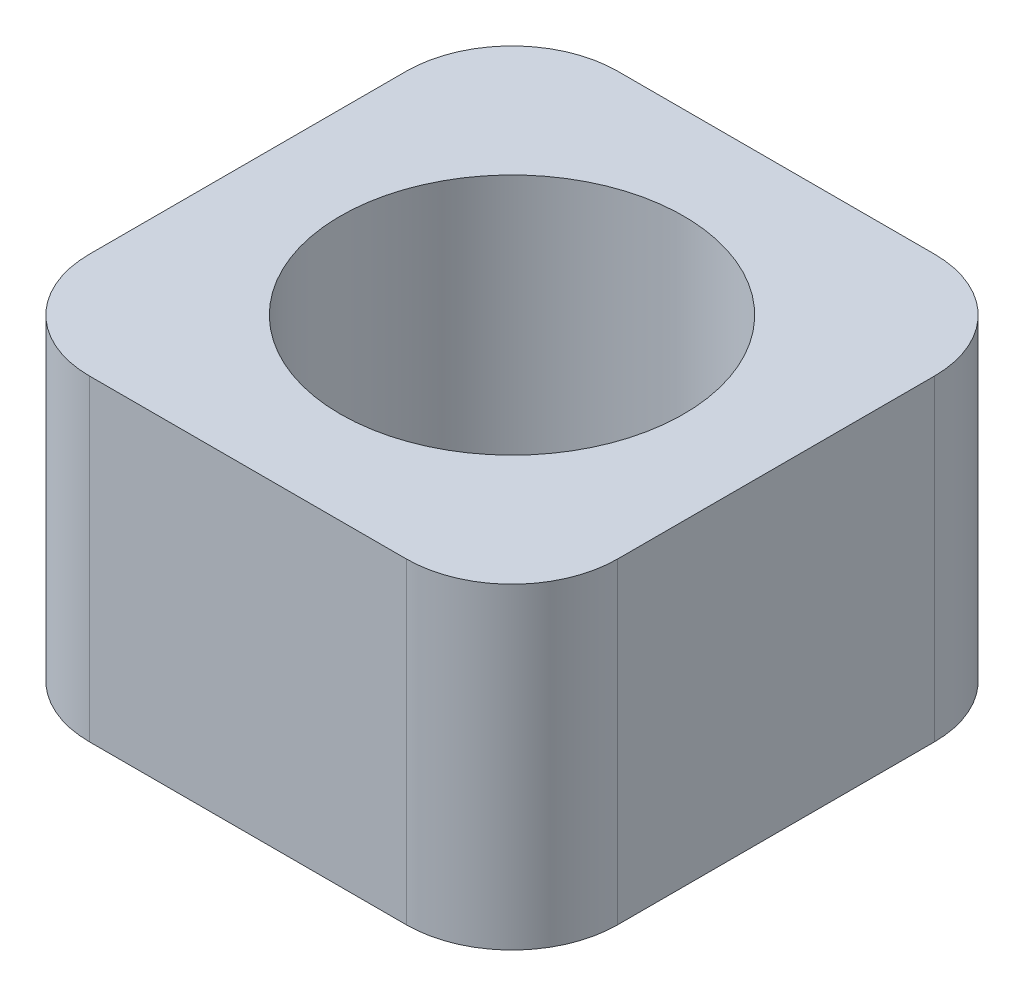
from build123d import *

# Parameters (mm, degrees)
SKETCH1_R           = 5
SKETCH1_R_2         = 3.25
BOSS_EXTRUDE1_DEPTH = 3
FILLET1_R           = 2


with BuildPart() as part:
    # Sketch1 → Boss-Extrude1 (new, symmetric)
    # profile 1 of 5: a face of its own
    with BuildSketch(Plane(origin=(0, 0, 0), x_dir=(1, 0, 0), z_dir=(0, 1, 0))):
        with BuildLine():
            Line((-5, 5), (-5, 0))
            ThreePointArc((-5, 0), (-3.535533906, 3.535533906), (0, 5))
            Line((0, 5), (-5, 5))
        make_face()
    # profile 2 of 5: a face of its own
    with BuildSketch(Plane(origin=(0, 0, 0), x_dir=(1, 0, 0), z_dir=(0, 1, 0))):
        Circle(SKETCH1_R)
        with Locations(Location((0, 0, 0), (0, 0, 270))):
            Circle(SKETCH1_R_2, mode=Mode.SUBTRACT)
    # profile 3 of 5: a face of its own
    with BuildSketch(Plane(origin=(0, 0, 0), x_dir=(1, 0, 0), z_dir=(0, 1, 0))):
        with BuildLine():
            ThreePointArc((0, 5), (3.535533906, 3.535533906), (5, 0))
            Line((5, 0), (5, 5))
            Line((5, 5), (0, 5))
        make_face()
    # profile 4 of 5: a face of its own
    with BuildSketch(Plane(origin=(0, 0, 0), x_dir=(1, 0, 0), z_dir=(0, 1, 0))):
        with BuildLine():
            ThreePointArc((5, 0), (3.535533906, -3.535533906), (0, -5))
            Line((0, -5), (5, -5))
            Line((5, -5), (5, 0))
        make_face()
    # profile 5 of 5: a face of its own
    with BuildSketch(Plane(origin=(0, 0, 0), x_dir=(1, 0, 0), z_dir=(0, 1, 0))):
        with BuildLine():
            Line((-5, 0), (-5, -5))
            Line((-5, -5), (0, -5))
            ThreePointArc((0, -5), (-3.535533906, -3.535533906), (-5, 0))
        make_face()
    extrude(amount=BOSS_EXTRUDE1_DEPTH, both=True)

    # Fillet1
    fillet1_edges = [part.edges().sort_by_distance(p)[0] for p in [
        (-5, 0, -5),
        (5, 0, -5),
        (5, 0, 5),
        (-5, 0, 5),
    ]]
    fillet(fillet1_edges, radius=FILLET1_R)


solid = part.part
